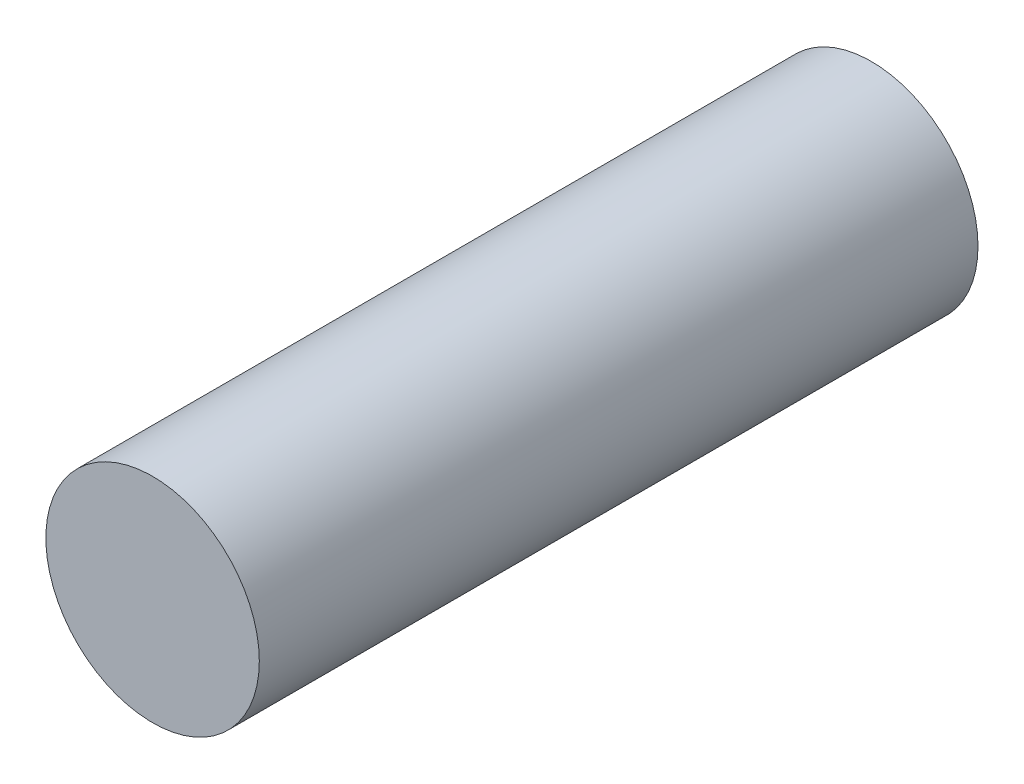
from build123d import *

# Parameters (mm, degrees)
SKETCH1_R           = 7.62
BOSS_EXTRUDE1_DEPTH = 51.308


with BuildPart() as part:
    # Sketch1 → Boss-Extrude1 (new body)
    with BuildSketch(Plane.XY):
        Circle(SKETCH1_R)
    extrude(amount=BOSS_EXTRUDE1_DEPTH)


solid = part.part
